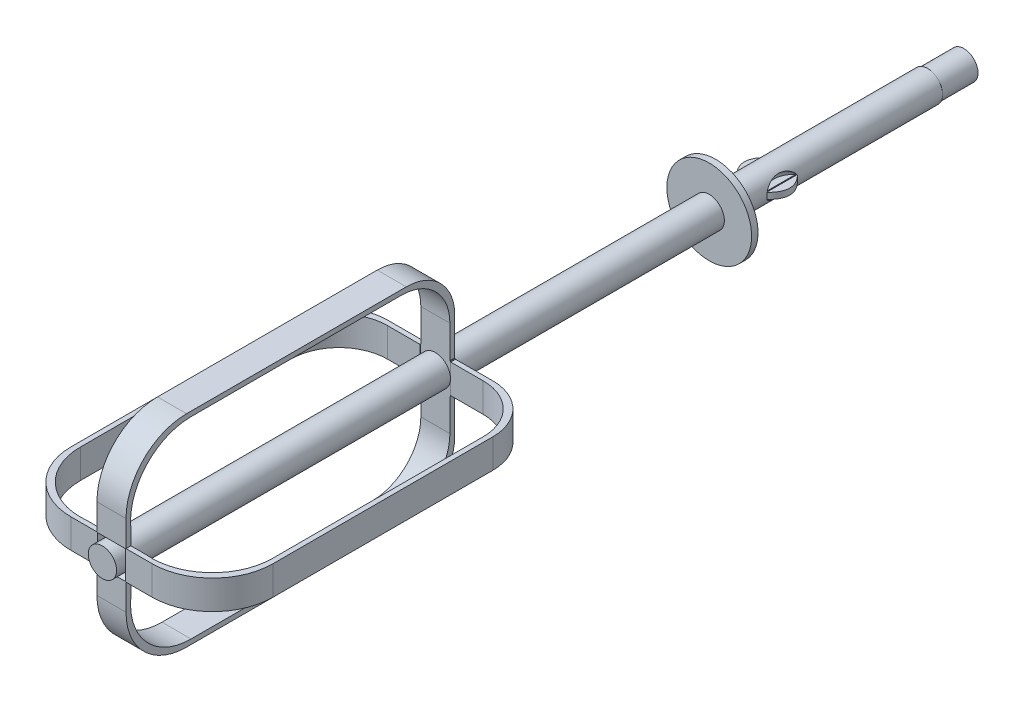
from build123d import *

# Parameters (mm, degrees)
SKETCH1_R            = 3.175
BOSS_EXTRUDE1_DEPTH  = 177.8
SKETCH2_R            = 2.9718
BOSS_EXTRUDE2_DEPTH  = 7.874
BOSS_EXTRUDE3_DEPTH  = 0.6477
SKETCH2_7_OUTSIDE_W  = 47.16
SKETCH2_7_OUTSIDE_H  = 43.984
SKETCH2_7_OUTSIDE_R  = 2.9718
CUT_EXTRUDE2_DEPTH   = 7.62
SKETCH9_W            = 1.3462
SKETCH9_H            = 5.715
SKETCH31_R           = 2.9718
BOSS_EXTRUDE6_DEPTH  = 2.921
SKETCH32_W           = 6.263880776
SKETCH32_H           = 6.416852852
BOSS_EXTRUDE9_DEPTH  = 1.016
BOSS_EXTRUDE10_DEPTH = 3.048
CIRPATTERN1_COUNT    = 4
CUT_REVOLVE3_ANGLE   = 180
MIRROR3_COPY_1_ANGLE = 180


with BuildPart() as part:
    # Sketch1 → Boss-Extrude1 (new body)
    with BuildSketch(Plane.XY):
        Circle(SKETCH1_R)
    extrude(amount=BOSS_EXTRUDE1_DEPTH)

    # Sketch2 → Boss-Extrude2 (add)
    with BuildSketch(Plane.XY):
        Circle(SKETCH2_R)
    extrude(amount=BOSS_EXTRUDE2_DEPTH)

    # Sketch3 → Boss-Extrude3 (add, symmetric)
    with BuildSketch(Plane(origin=(0, 0, 0), x_dir=(1, 0, 0), z_dir=(0, 1, 0))):
        with BuildLine():
            Line((-3.175, -38.1), (3.175, -38.1))
            add(Edge.make_bspline(
                [(3.175, -38.1), (6.35, -41.275), (3.175, -44.45)],
                knots=[0, 0, 0, 1, 1, 1], degree=2))
            Line((3.175, -44.45), (-3.175, -44.45))
            add(Edge.make_bspline(
                [(-3.175, -38.1), (-6.35, -41.275), (-3.175, -44.45)],
                knots=[0, 0, 0, 1, 1, 1], degree=2))
        make_face()
    extrude(amount=BOSS_EXTRUDE3_DEPTH, both=True)

    # Sketch2<7> outside → Cut-Extrude2 (cut)
    with BuildSketch(Plane.XY):
        Rectangle(SKETCH2_7_OUTSIDE_W, SKETCH2_7_OUTSIDE_H)
        with Locations(Location((0, 0, 0), (0, 0, 180))):
            Circle(SKETCH2_7_OUTSIDE_R, mode=Mode.SUBTRACT)
    extrude(amount=CUT_EXTRUDE2_DEPTH, mode=Mode.SUBTRACT)

    # Sketch31 → Boss-Extrude6 (add)
    with BuildSketch(Plane.XY.offset(177.8)):
        with Locations(Location((0, 0, 0), (0, 0, 180))):
            Circle(SKETCH31_R)
    extrude(amount=BOSS_EXTRUDE6_DEPTH)

    # Sketch32 → Boss-Extrude9 (add)
    with BuildSketch(Plane.XY.offset(109.855)):
        Rectangle(SKETCH32_W, SKETCH32_H)
    extrude(amount=BOSS_EXTRUDE9_DEPTH)

    # Sketch30 → Boss-Extrude10 (add, symmetric)
    with BuildSketch(Plane(origin=(0, 0, 0), x_dir=(0, 0, -1), z_dir=(1, 0, 0))):
        with BuildLine():
            Line((-120.015, 21.209), (-166.116, 21.209))
            ThreePointArc((-166.116, 21.209), (-175.096256121, 17.489256121), (-178.816, 8.509))
            Line((-178.816, 8.509), (-178.816, 2.9718))
            Line((-178.816, 2.9718), (-177.8, 2.205888301))
            Line((-177.8, 2.205888301), (-177.8, 6.210195024))
            ThreePointArc((-177.8, 6.210195024), (-174.587840698, 16.007645524), (-165.164953051, 20.193))
            Line((-165.164953051, 20.193), (-121.031, 20.193))
            ThreePointArc((-121.031, 20.193), (-113.846795103, 17.217204897), (-110.871, 10.033))
            Line((-110.871, 10.033), (-110.871, 3.208426426))
            Line((-110.871, 3.208426426), (-109.855, 3.208426426))
            Line((-109.855, 3.208426426), (-109.855, 11.049))
            ThreePointArc((-109.855, 11.049), (-112.830795103, 18.233204897), (-120.015, 21.209))
        make_face()
    boss_extrude10 = extrude(amount=BOSS_EXTRUDE10_DEPTH, both=True)

    # CirPattern1: Boss-Extrude10 ×4 about axis
    cirpattern1_axis = Axis((0, 0, 0), (0, 0, 1))
    for i in range(1, CIRPATTERN1_COUNT):
        add(boss_extrude10.rotate(cirpattern1_axis, i * 360 / CIRPATTERN1_COUNT))

    # Sketch36 → Cut-Revolve3 (revolve, cut)
    with BuildSketch(Plane(origin=(0, -0.6477, 0), x_dir=(-1, 0, 0), z_dir=(0, -1, 0))):
        with BuildLine():
            Line((-3.256634196, -38.182711551), (-3.256634196, -44.367288449))
            ThreePointArc((-3.256634196, -44.367288449), (-4.747079201, -41.275), (-3.256634196, -38.182711551))
        make_face()
    cut_revolve3 = revolve(axis=Axis((3.10823257, -0.6477, 38.1), (0, 0, -1)), revolution_arc=CUT_REVOLVE3_ANGLE, mode=Mode.SUBTRACT)

    # Mirror1: Cut-Revolve3 across plane
    add(cut_revolve3.mirror(Plane.ZX), mode=Mode.SUBTRACT)

    # Mirror3: Cut-Revolve3 across plane
    add(cut_revolve3.mirror(Plane(origin=(0, 0, 0), x_dir=(0, 0, 1), z_dir=(1, 0, 0))), mode=Mode.SUBTRACT)

    # Mirror3 copy 1 sketch → Mirror3 copy 1 (revolve, cut)
    with BuildSketch(Plane(origin=(0, 0.6477, 0), x_dir=(1, 0, 0), z_dir=(0, 1, 0))):
        with BuildLine():
            Line((-3.256634196, -38.182711551), (-3.256634196, -44.367288449))
            ThreePointArc((-3.256634196, -44.367288449), (-4.747079201, -41.275), (-3.256634196, -38.182711551))
        make_face()
    revolve(axis=Axis((-3.10823257, 0.6477, 38.1), (0, 0, -1)), revolution_arc=MIRROR3_COPY_1_ANGLE, mode=Mode.SUBTRACT)


with BuildPart() as body_2:
    # Sketch9 → Revolve2 (revolve)
    with BuildSketch(Plane(origin=(0, 0, 0), x_dir=(0, 0, -1), z_dir=(1, 0, 0)), mode=Mode.PRIVATE) as revolve2_sk:
        with Locations((-52.7431, 6.0325)):
            Rectangle(SKETCH9_W, SKETCH9_H)
    revolve(revolve2_sk.sketch.rotate(Axis((0, 0, -88.99), (0, 0, 1)), 90), axis=Axis((0, 0, -88.99), (0, 0, 1)))


solid = Compound([part.part, body_2.part])
